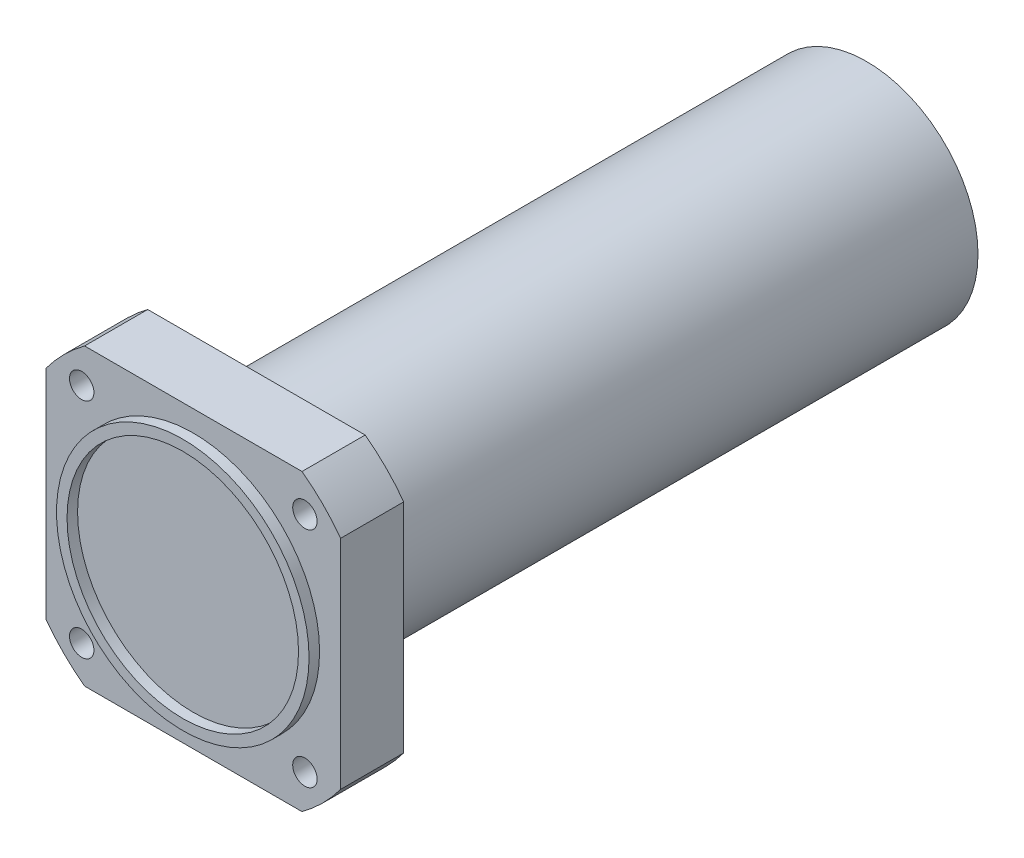
from build123d import *

# Parameters (mm, degrees)
SKETCH_2_W              = 2.5
SKETCH_2_H              = 2.5
SKETCH_2_W_2            = 145
SKETCH_2_H_2            = 26.443328262
EXTRUDE_1_DEPTH         = 35
EXTRUDE_1_DEPTH_BACK    = 35
SKETCH_2_4_W            = 15
SKETCH_2_4_H            = 70
CUT_EXTRUDE_1_DEPTH     = 168.493194588
HOLE_WIZARD_5_8_5_8_1_D = 5.8


with BuildPart() as part:
    # Эскиз2 → Повернуть2 (revolve)
    with BuildSketch(Plane(origin=(0, 0, 0), x_dir=(0, 0, -1), z_dir=(1, 0, 0))):
        with Locations((-161.25, -28.806671738)):
            Rectangle(SKETCH_2_W, SKETCH_2_H)
        with Locations((-72.5, -13.278335869)):
            Rectangle(SKETCH_2_W_2, SKETCH_2_H_2)
    revolve(axis=Axis((0, -0.056671738, 165.890142235), (0, 0, -1)))

    # Эскиз2<4> → Бобышка-Вытянуть1 (add, two sides: drawn at the far end of the back side and taken through both)
    with BuildSketch(Plane(origin=(0, 0, 0), x_dir=(0, 0, -1), z_dir=(1, 0, 0)).offset(-EXTRUDE_1_DEPTH_BACK)):
        with Locations((-152.5, -0.056671738)):
            Rectangle(SKETCH_2_4_W, SKETCH_2_4_H)
    extrude(amount=EXTRUDE_1_DEPTH + EXTRUDE_1_DEPTH_BACK)

    # Эскиз4 → Вырез-Вытянуть1 (cut, through all)
    with BuildSketch(Plane.XY.offset(160)):
        with BuildLine():
            ThreePointArc((35, -25.887854444), (30.759144982, -30.815816719), (25.831182706, -35.056671738))
            Line((25.831182706, -35.056671738), (35, -35.056671738))
            Line((35, -35.056671738), (35, -25.887854444))
        make_face()
        with BuildLine():
            Line((-35, -35.056671738), (-25.831182706, -35.056671738))
            ThreePointArc((-25.831182706, -35.056671738), (-30.759144982, -30.815816719), (-35, -25.887854444))
            Line((-35, -25.887854444), (-35, -35.056671738))
        make_face()
        with BuildLine():
            ThreePointArc((25.831182706, 34.943328262), (30.759144982, 30.702473244), (35, 25.774510968))
            Line((35, 25.774510968), (35, 34.943328262))
            Line((35, 34.943328262), (25.831182706, 34.943328262))
        make_face()
        with BuildLine():
            ThreePointArc((-35, 25.774510968), (-30.759144982, 30.702473244), (-25.831182706, 34.943328262))
            Line((-25.831182706, 34.943328262), (-35, 34.943328262))
            Line((-35, 34.943328262), (-35, 25.774510968))
        make_face()
    extrude(amount=-CUT_EXTRUDE_1_DEPTH, mode=Mode.SUBTRACT)

    # Диаметр отверстия Ø5.8 (5.8)1 (through all)
    with Locations(Plane(origin=(-26.516504294, -26.573176032, 160), x_dir=(0, 1, 0), z_dir=(0, 0, 1))):
        with Locations((0, 0), (0, -53.033008588), (53.033008589, -53.033008588), (53.033008589, 0)):
            Hole(HOLE_WIZARD_5_8_5_8_1_D / 2)


solid = part.part
